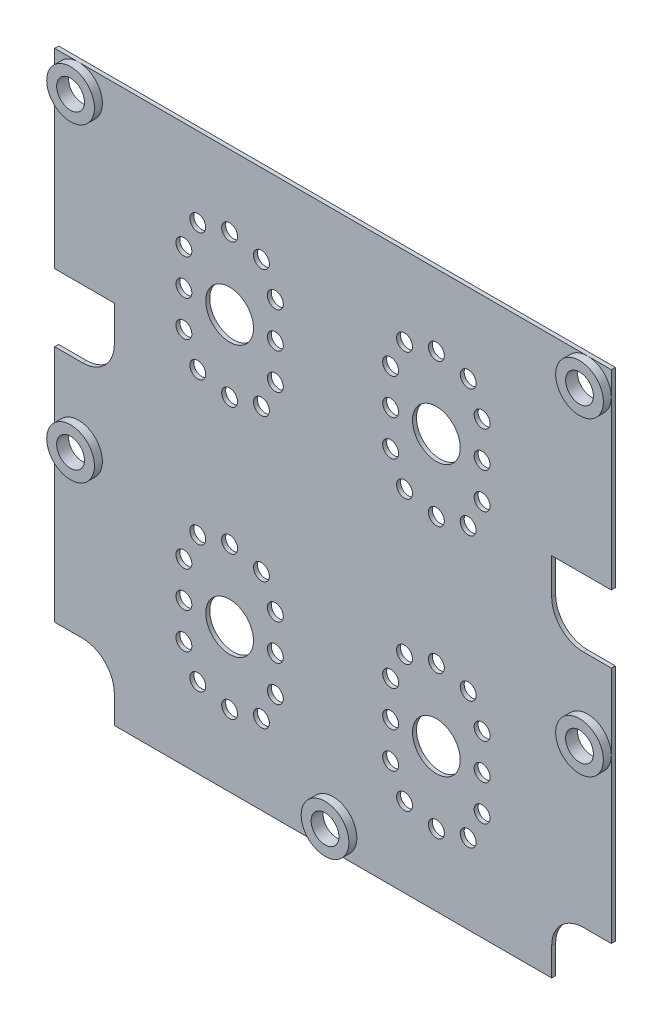
from build123d import *

# Parameters (mm, degrees)
SKETCH1_W               = 70
SKETCH1_H               = 70
BOSS_EXTRUDE1_DEPTH     = 0.5
SKETCH2_R               = 3
CUT_EXTRUDE1_DEPTH      = 50.5
SKETCH3_R               = 1
CUT_EXTRUDE2_DEPTH      = 50.5
MIRROR2_COPY_1_SKETCH_R = 3
MIRROR2_COPY_1_DEPTH    = 50.5
MIRROR2_COPY_2_SKETCH_R = 1
MIRROR2_COPY_2_DEPTH    = 50.5
SKETCH4_R               = 3
BOSS_EXTRUDE2_DEPTH     = 1
SKETCH5_R               = 1.75
CUT_EXTRUDE3_DEPTH      = 50.520197899
SKETCH6_W               = 8.5
SKETCH6_H               = 8.5
CUT_EXTRUDE4_DEPTH      = 50.507575178
FILLET1_R               = 4
SKETCH7_R               = 3
BOSS_EXTRUDE3_DEPTH     = 1
SKETCH8_R               = 1.75
CUT_EXTRUDE5_DEPTH      = 50.520197899
FILLET1_OF_MIRROR3_R    = 4


with BuildPart() as part:
    # Sketch1 → Boss-Extrude1 (new body)
    with BuildSketch(Plane.XY):
        Rectangle(SKETCH1_W, SKETCH1_H)
    extrude(amount=BOSS_EXTRUDE1_DEPTH)

    # Sketch2 → Cut-Extrude1 (cut, through all)
    with BuildSketch(Plane.XY.offset(0.5)):
        with Locations((-13, 17)):
            Circle(SKETCH2_R)
    cut_extrude1 = extrude(amount=-CUT_EXTRUDE1_DEPTH, mode=Mode.SUBTRACT)

    # Sketch3 → Cut-Extrude2 (cut, through all)
    with BuildSketch(Plane.XY.offset(0.5)):
        with Locations((-7.25, 21.5)):
            Circle(SKETCH3_R)
        with Locations((-7.25, 17)):
            Circle(SKETCH3_R)
        with Locations((-7.25, 12.5)):
            Circle(SKETCH3_R)
        with Locations((-9, 9)):
            Circle(SKETCH3_R)
        with Locations((-9, 25)):
            Circle(SKETCH3_R)
        with Locations((-13, 26)):
            Circle(SKETCH3_R)
        with Locations((-13, 8)):
            Circle(SKETCH3_R)
        with Locations(Location((-17, 9, 0), (0, 0, 180))):
            Circle(SKETCH3_R)
        with Locations(Location((-18.75, 12.5, 0), (0, 0, 180))):
            Circle(SKETCH3_R)
        with Locations(Location((-18.75, 17, 0), (0, 0, 180))):
            Circle(SKETCH3_R)
        with Locations(Location((-18.75, 21.5, 0), (0, 0, 180))):
            Circle(SKETCH3_R)
        with Locations(Location((-17, 25, 0), (0, 0, 180))):
            Circle(SKETCH3_R)
    cut_extrude2 = extrude(amount=-CUT_EXTRUDE2_DEPTH, mode=Mode.SUBTRACT)

    # Mirror1: Cut-Extrude1, Cut-Extrude2 across plane
    add(cut_extrude1.mirror(Plane(origin=(0, 0, 0), x_dir=(0, 0, 1), z_dir=(1, 0, 0))), mode=Mode.SUBTRACT)
    add(cut_extrude2.mirror(Plane(origin=(0, 0, 0), x_dir=(0, 0, 1), z_dir=(1, 0, 0))), mode=Mode.SUBTRACT)

    # Mirror2: Cut-Extrude1, Cut-Extrude2 across plane
    add(cut_extrude1.mirror(Plane.ZX), mode=Mode.SUBTRACT)
    add(cut_extrude2.mirror(Plane.ZX), mode=Mode.SUBTRACT)

    # Mirror2 copy 1 sketch → Mirror2 copy 1 (cut, through all)
    with BuildSketch(Plane(origin=(0, 0, 0.5), x_dir=(-1, 0, 0), z_dir=(0, 0, 1))):
        with Locations((-13, 17)):
            Circle(MIRROR2_COPY_1_SKETCH_R)
    extrude(amount=-MIRROR2_COPY_1_DEPTH, mode=Mode.SUBTRACT)

    # Mirror2 copy 2 sketch → Mirror2 copy 2 (cut, through all)
    with BuildSketch(Plane(origin=(0, 0, 0.5), x_dir=(-1, 0, 0), z_dir=(0, 0, 1))):
        with Locations((-7.25, 21.5)):
            Circle(MIRROR2_COPY_2_SKETCH_R)
        with Locations((-7.25, 17)):
            Circle(MIRROR2_COPY_2_SKETCH_R)
        with Locations((-7.25, 12.5)):
            Circle(MIRROR2_COPY_2_SKETCH_R)
        with Locations((-9, 9)):
            Circle(MIRROR2_COPY_2_SKETCH_R)
        with Locations((-9, 25)):
            Circle(MIRROR2_COPY_2_SKETCH_R)
        with Locations((-13, 26)):
            Circle(MIRROR2_COPY_2_SKETCH_R)
        with Locations((-13, 8)):
            Circle(MIRROR2_COPY_2_SKETCH_R)
        with Locations(Location((-17, 9, 0), (0, 0, 180))):
            Circle(MIRROR2_COPY_2_SKETCH_R)
        with Locations(Location((-18.75, 12.5, 0), (0, 0, 180))):
            Circle(MIRROR2_COPY_2_SKETCH_R)
        with Locations(Location((-18.75, 17, 0), (0, 0, 180))):
            Circle(MIRROR2_COPY_2_SKETCH_R)
        with Locations(Location((-18.75, 21.5, 0), (0, 0, 180))):
            Circle(MIRROR2_COPY_2_SKETCH_R)
        with Locations(Location((-17, 25, 0), (0, 0, 180))):
            Circle(MIRROR2_COPY_2_SKETCH_R)
    extrude(amount=-MIRROR2_COPY_2_DEPTH, mode=Mode.SUBTRACT)

    # Sketch4 → Boss-Extrude2 (add)
    with BuildSketch(Plane.XY.offset(0.5)):
        with Locations(Location((-32, 32, 0), (0, 0, 180))):
            Circle(SKETCH4_R)
        with Locations(Location((-32, -7, 0), (0, 0, 180))):
            Circle(SKETCH4_R)
    boss_extrude2 = extrude(amount=BOSS_EXTRUDE2_DEPTH)

    # Sketch5 → Cut-Extrude3 (cut, through all)
    with BuildSketch(Plane.XY.offset(1.5)):
        with Locations((-32, 32)):
            Circle(SKETCH5_R)
        with Locations((-32, -7)):
            Circle(SKETCH5_R)
    cut_extrude3 = extrude(amount=-CUT_EXTRUDE3_DEPTH, mode=Mode.SUBTRACT)

    # Sketch6 → Cut-Extrude4 (cut, through all)
    with BuildSketch(Plane.XY.offset(0.5)):
        with Locations((-31.75, -31.75)):
            Rectangle(SKETCH6_W, SKETCH6_H)
        with Locations((-31.75, 6.75)):
            Rectangle(SKETCH6_W, SKETCH6_H)
    cut_extrude4 = extrude(amount=-CUT_EXTRUDE4_DEPTH, mode=Mode.SUBTRACT)

    # Fillet1
    fillet1_edges = [part.edges().sort_by_distance(p)[0] for p in [
        (-27.5, -27.5, 0.25),
        (-27.5, 2.5, 0.25),
    ]]
    fillet(fillet1_edges, radius=FILLET1_R)

    # Sketch7 → Boss-Extrude3 (add)
    with BuildSketch(Plane.XY.offset(0.5)):
        with Locations(Location((0, -32, 0), (0, 0, 270))):
            Circle(SKETCH7_R)
    extrude(amount=BOSS_EXTRUDE3_DEPTH)

    # Sketch8 → Cut-Extrude5 (cut, through all)
    with BuildSketch(Plane.XY.offset(1.5)):
        with Locations((0, -32)):
            Circle(SKETCH8_R)
    extrude(amount=-CUT_EXTRUDE5_DEPTH, mode=Mode.SUBTRACT)

    # Mirror3: Boss-Extrude2, Cut-Extrude3, Cut-Extrude4 across plane
    add(boss_extrude2.mirror(Plane(origin=(0, 0, 0), x_dir=(0, 0, 1), z_dir=(1, 0, 0))))
    add(cut_extrude3.mirror(Plane(origin=(0, 0, 0), x_dir=(0, 0, 1), z_dir=(1, 0, 0))), mode=Mode.SUBTRACT)
    add(cut_extrude4.mirror(Plane(origin=(0, 0, 0), x_dir=(0, 0, 1), z_dir=(1, 0, 0))), mode=Mode.SUBTRACT)

    # Fillet1 of Mirror3
    fillet1_of_mirror3_edges = [part.edges().sort_by_distance(p)[0] for p in [
        (27.5, -27.5, 0.25),
        (27.5, 2.5, 0.25),
    ]]
    fillet(fillet1_of_mirror3_edges, radius=FILLET1_OF_MIRROR3_R)


solid = part.part
